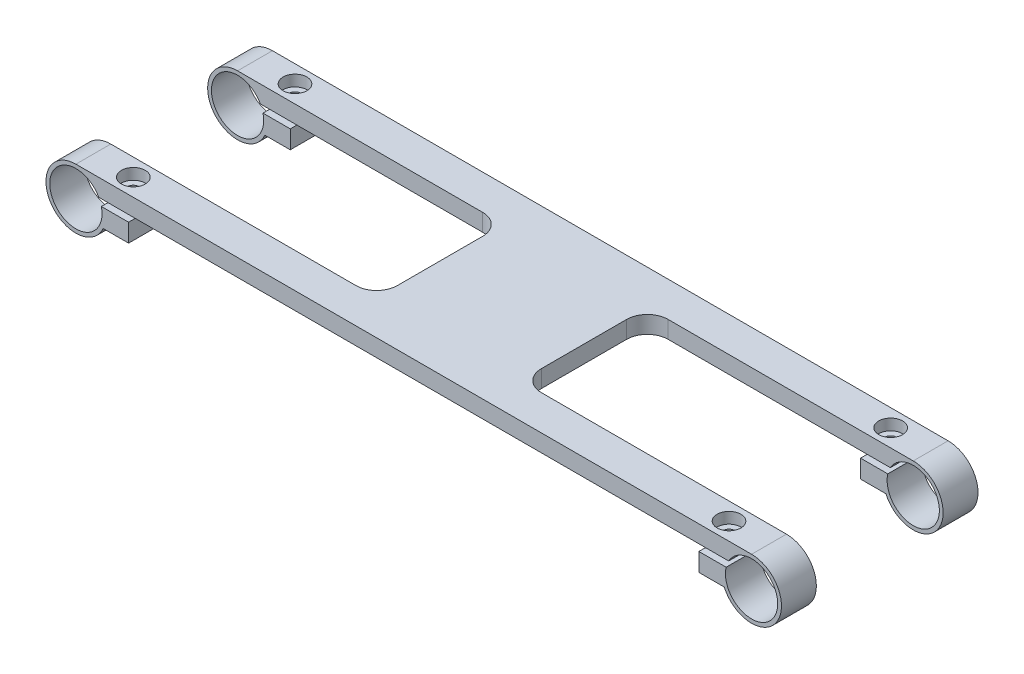
from build123d import *

# Parameters (mm, degrees)
BOSS_EXTRUDE1_DEPTH = 22.5425
CUT_EXTRUDE1_DEPTH  = 14.605
SKETCH3_R           = 1.3462
CUT_EXTRUDE2_DEPTH  = 11.1125
SKETCH4_R           = 2.7305
CUT_EXTRUDE3_DEPTH  = 2.54
SCALE1_SCALE        = 0.6


with BuildPart() as part:
    # Sketch1 → Boss-Extrude1 (new, symmetric)
    with BuildSketch(Plane.XY):
        with BuildLine():
            Line((-77.49921, 0), (77.49921, 0))
            ThreePointArc((77.49921, 0), (83.25218384, -10.591022368), (71.236165373, -9.652))
            Line((71.236165373, -9.652), (65.40881, -9.652))
            Line((65.40881, -9.652), (65.40881, -5.4864))
            Line((65.40881, -5.4864), (71.663839849, -5.4864))
            ThreePointArc((71.663839849, -5.4864), (83.093360732, -9.011673362), (72.250559507, -3.9624))
            Line((72.250559507, -3.9624), (-72.250559507, -3.9624))
            ThreePointArc((-72.250559507, -3.9624), (-83.093360732, -9.011673362), (-71.663839849, -5.4864))
            Line((-71.663839849, -5.4864), (-65.40881, -5.4864))
            Line((-65.40881, -5.4864), (-65.40881, -9.652))
            Line((-65.40881, -9.652), (-71.236165373, -9.652))
            ThreePointArc((-71.236165373, -9.652), (-83.25218384, -10.591022368), (-77.49921, 0))
        make_face()
    extrude(amount=BOSS_EXTRUDE1_DEPTH, both=True)

    # Sketch2 → Cut-Extrude1 (cut)
    with BuildSketch(Plane(origin=(0, 0, 0), x_dir=(1, 0, 0), z_dir=(0, 1, 0))):
        with BuildLine():
            Line((84.35721, -14.5415), (84.35721, 14.5415))
            Line((84.35721, 14.5415), (21.2725, 14.5415))
            ThreePointArc((21.2725, 14.5415), (17.904903955, 13.146596045), (16.51, 9.779))
            Line((16.51, 9.779), (16.51, -9.779))
            ThreePointArc((16.51, -9.779), (17.904903955, -13.146596045), (21.2725, -14.5415))
            Line((21.2725, -14.5415), (84.35721, -14.5415))
        make_face()
        with BuildLine():
            Line((-84.35721, 14.5415), (-84.35721, -14.5415))
            Line((-84.35721, -14.5415), (-21.2725, -14.5415))
            ThreePointArc((-21.2725, -14.5415), (-17.904903955, -13.146596045), (-16.51, -9.779))
            Line((-16.51, -9.779), (-16.51, 9.779))
            ThreePointArc((-16.51, 9.779), (-17.904903955, 13.146596045), (-21.2725, 14.5415))
            Line((-21.2725, 14.5415), (-84.35721, 14.5415))
        make_face()
    extrude(amount=-CUT_EXTRUDE1_DEPTH, mode=Mode.SUBTRACT)

    # Sketch3 → Cut-Extrude2 (cut, symmetric)
    with BuildSketch(Plane.XZ.offset(9.652)):
        with Locations((68.322487686, 18.542)):
            Circle(SKETCH3_R)
        with Locations((68.322487686, -18.542)):
            Circle(SKETCH3_R)
        with Locations((-68.322487686, -18.542)):
            Circle(SKETCH3_R)
        with Locations(Location((-68.322487686, 18.542, 0), (0, 0, 270))):
            Circle(SKETCH3_R)
    extrude(amount=CUT_EXTRUDE2_DEPTH, both=True, mode=Mode.SUBTRACT)

    # Sketch4 → Cut-Extrude3 (cut)
    with BuildSketch(Plane(origin=(0, 0, 0), x_dir=(1, 0, 0), z_dir=(0, 1, 0))):
        with Locations(Location((-68.322487686, 18.542, 0), (0, 0, 180))):
            Circle(SKETCH4_R)
        with Locations(Location((-68.322487686, -18.542, 0), (0, 0, 180))):
            Circle(SKETCH4_R)
        with Locations(Location((68.322487686, -18.542, 0), (0, 0, 180))):
            Circle(SKETCH4_R)
        with Locations(Location((68.322487686, 18.542, 0), (0, 0, 180))):
            Circle(SKETCH4_R)
    extrude(amount=-CUT_EXTRUDE3_DEPTH, mode=Mode.SUBTRACT)


with BuildPart() as part_1:
    # Scale1: scaled about (0, -2.581706213, 0)
    add(part.part.scale(SCALE1_SCALE).moved(Location((0, -1.032682485, 0))))


solid = part_1.part
